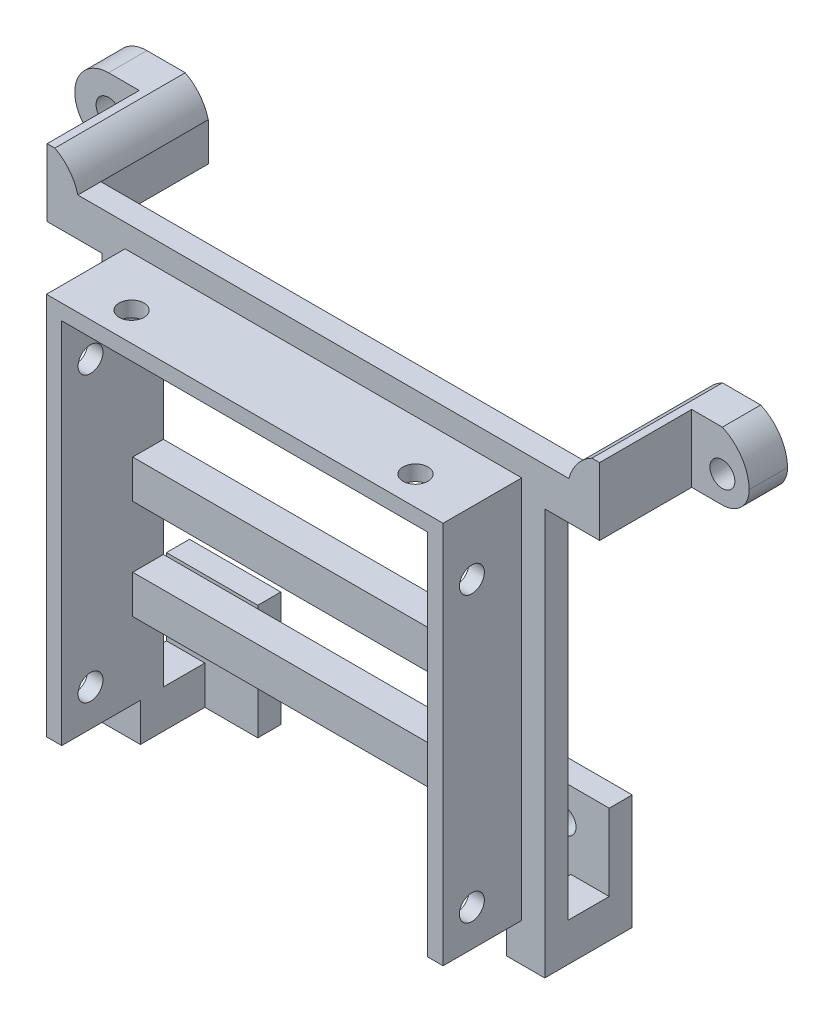
from build123d import *

# Parameters (mm, degrees)
CROQUIS1_R                = 1.625
SALIENTE_EXTRUIR1_DEPTH   = 5
SALIENTE_EXTRUIR1_2_DEPTH = 5
SALIENTE_EXTRUIR2_DEPTH   = 12
SALIENTE_EXTRUIR4_DEPTH   = 3
SALIENTE_EXTRUIR6_DEPTH   = 10.25
CROQUIS12_R               = 1.625
CORTAR_EXTRUIR1_DEPTH     = 51.7
CROQUIS13_R               = 1.625
CORTAR_EXTRUIR2_DEPTH     = 2
CROQUIS14_W               = 5
CROQUIS14_H               = 5
SALIENTE_EXTRUIR7_DEPTH   = 11.4
CROQUIS15_W               = 11.9
CROQUIS15_H               = 14.969217292
CROQUIS15_R               = 1.625
SALIENTE_EXTRUIR8_DEPTH   = 3
CROQUIS16_W               = 47.7
CROQUIS16_H               = 5
SALIENTE_EXTRUIR9_DEPTH   = 4


with BuildPart() as part:
    # Croquis1 → Saliente-Extruir1 (new body)
    with BuildSketch(Plane.XY):
        with BuildLine():
            Line((190, -61.4), (182, -61.4))
            Line((182, -61.4), (182, -56.4))
            ThreePointArc((182, -56.4), (183.099702641, -54.183975769), (185, -52.6))
            Line((185, -52.6), (190, -52.6))
            ThreePointArc((190, -52.6), (192.511852896, -54.746889597), (193.5, -57.9))
            ThreePointArc((193.5, -57.9), (192.474873734, -60.374873734), (190, -61.4))
        make_face()
        with Locations((190, -57.9)):
            Circle(CROQUIS1_R, mode=Mode.SUBTRACT)
    extrude(amount=SALIENTE_EXTRUIR1_DEPTH)



with BuildPart() as body_2:
    # Croquis1 → Saliente-Extruir1 2 (new body)
    with BuildSketch(Plane.XY):
        with BuildLine():
            Line((115, -52.6), (110, -52.6))
            ThreePointArc((110, -52.6), (105.6, -57), (110, -61.4))
            Line((110, -61.4), (118, -61.4))
            Line((118, -61.4), (118, -56.4))
            ThreePointArc((118, -56.4), (116.900297359, -54.183975769), (115, -52.6))
        make_face()
        with Locations((110, -57)):
            Circle(CROQUIS1_R, mode=Mode.SUBTRACT)
    extrude(amount=SALIENTE_EXTRUIR1_2_DEPTH)


with BuildPart() as part_1:
    add(part.part)

    add(body_2.part)  # Saliente-Extruir2 merges body 2
    # Croquis4 → Saliente-Extruir2 (add)
    with BuildSketch(Plane.XY.offset(5)):
        with BuildLine():
            Line((115, -52.6), (114, -52.6))
            Line((114, -52.6), (114, -61.4))
            Line((114, -61.4), (118, -61.4))
            Line((118, -61.4), (118, -56.4))
            ThreePointArc((118, -56.4), (116.900297359, -54.183975769), (115, -52.6))
        make_face()
        with BuildLine():
            Line((185, -52.6), (186, -52.6))
            Line((186, -52.6), (186, -61.4))
            Line((186, -61.4), (182, -61.4))
            Line((182, -61.4), (182, -56.4))
            ThreePointArc((182, -56.4), (183.099702641, -54.183975769), (185, -52.6))
        make_face()
    extrude(amount=SALIENTE_EXTRUIR2_DEPTH)

    # Croquis7 → Saliente-Extruir4 (add)
    with BuildSketch(Plane.XY.offset(17)):
        Polygon((118, -56.4), (182, -56.4), (182, -61.4), (178.85, -61.4), (178.85, -109.35), (173.85, -109.35), (173.85, -61.4), (170.85, -61.4), (129.15, -61.4), (126.15, -61.4), (126.15, -109.35), (121.15, -109.35), (121.15, -61.4), (118, -61.4), align=None)
    extrude(amount=-SALIENTE_EXTRUIR4_DEPTH)

    # Croquis10 → Saliente-Extruir6 (add)
    with BuildSketch(Plane.XY.offset(17)):
        Polygon((124.15, -59.4), (126.15, -59.4), (173.85, -59.4), (175.85, -59.4), (175.85, -109.35), (173.85, -109.35), (173.85, -61.4), (126.15, -61.4), (126.15, -109.35), (124.15, -109.35), align=None)
    extrude(amount=SALIENTE_EXTRUIR6_DEPTH)

    # Croquis12 → Cortar-Extruir1 (cut)
    with BuildSketch(Plane.ZY.offset(-124.15)):
        with Locations((23.5, -67.6)):
            Circle(CROQUIS12_R)
        with Locations((23.5, -104.6)):
            Circle(CROQUIS12_R)
    extrude(amount=-CORTAR_EXTRUIR1_DEPTH, mode=Mode.SUBTRACT)

    # Croquis13 → Cortar-Extruir2 (cut)
    with BuildSketch(Plane(origin=(0, -59.4, 0), x_dir=(1, 0, 0), z_dir=(0, 1, 0))):
        with Locations(Location((131.5, -23.5, 0), (0, 0, 270))):
            Circle(CROQUIS13_R)
        with Locations(Location((168.5, -23.5, 0), (0, 0, 270))):
            Circle(CROQUIS13_R)
    extrude(amount=-CORTAR_EXTRUIR2_DEPTH, mode=Mode.SUBTRACT)

    # Croquis14 → Saliente-Extruir7 (add)
    with BuildSketch(Plane.XY.offset(17)):
        with Locations((123.65, -111.85)):
            Rectangle(CROQUIS14_W, CROQUIS14_H)
        with Locations((176.35, -111.85)):
            Rectangle(CROQUIS14_W, CROQUIS14_H)
    extrude(amount=-SALIENTE_EXTRUIR7_DEPTH)

    # Croquis15 → Saliente-Extruir8 (add)
    # profile 1 of 2: a face of its own
    with BuildSketch(Plane(origin=(0, 0, 5.6), x_dir=(-1, 0, 0), z_dir=(0, 0, -1))):
        with Locations((-172.9, -106.865391354)):
            Rectangle(CROQUIS15_W, CROQUIS15_H)
        with Locations((-172.9, -103.7)):
            Circle(CROQUIS15_R, mode=Mode.SUBTRACT)
    # profile 2 of 2: a face of its own
    with BuildSketch(Plane(origin=(0, 0, 5.6), x_dir=(-1, 0, 0), z_dir=(0, 0, -1))):
        with Locations((-127.1, -106.865391354)):
            Rectangle(CROQUIS15_W, CROQUIS15_H)
        with Locations((-127.1, -103.8)):
            Circle(CROQUIS15_R, mode=Mode.SUBTRACT)
    extrude(amount=-SALIENTE_EXTRUIR8_DEPTH)

    # Croquis16 → Saliente-Extruir9 (add)
    with BuildSketch(Plane(origin=(0, 0, 14), x_dir=(-1, 0, 0), z_dir=(0, 0, -1))):
        with Locations((-150, -83.9)):
            Rectangle(CROQUIS16_W, CROQUIS16_H)
        with Locations((-150, -96.9)):
            Rectangle(CROQUIS16_W, CROQUIS16_H)
    extrude(amount=-SALIENTE_EXTRUIR9_DEPTH)


solid = part_1.part
